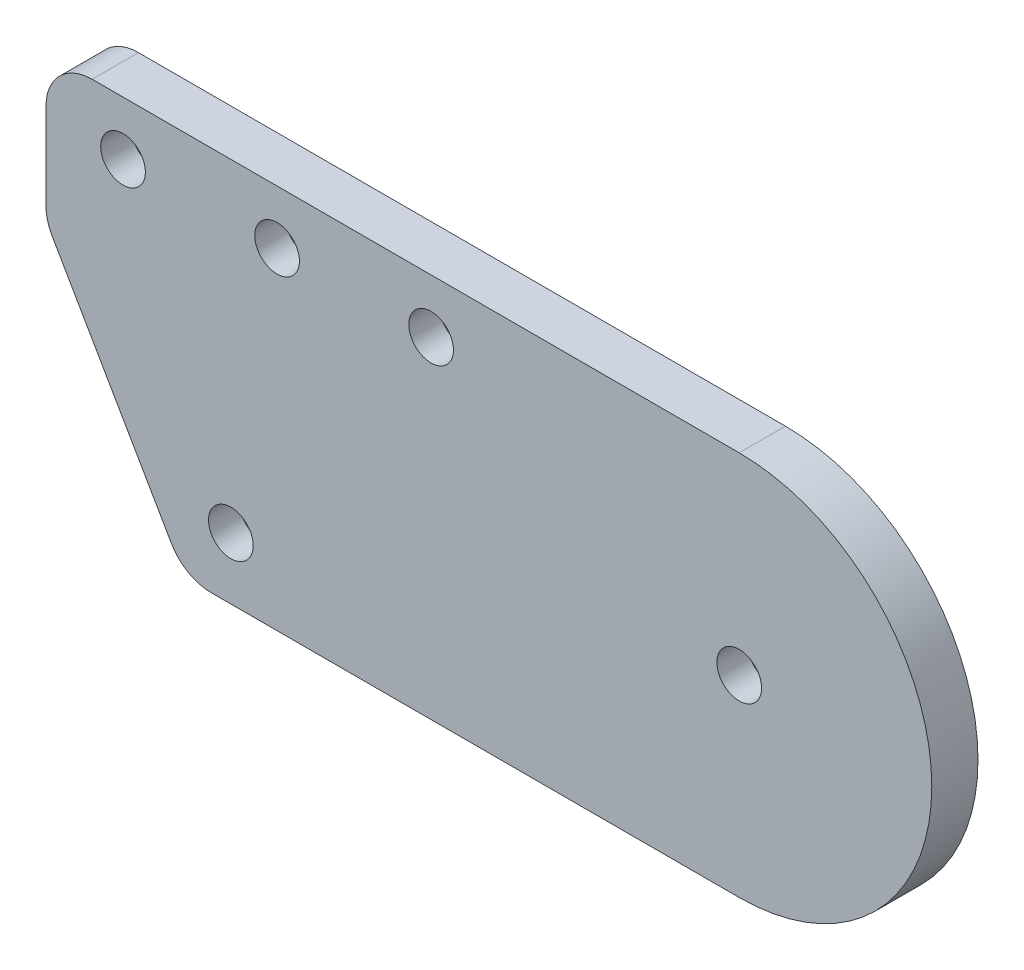
from build123d import *

# Parameters (mm, degrees)
SKETCH_2_R          = 1.45
EXTRUDE_1_DEPTH     = 3
SKETCH_3_R          = 1.45
EXTRUDE_2_DEPTH     = 3
SKETCH_6_R          = 3
CUT_EXTRUDE_2_DEPTH = 1
EXTRUDE_3_DEPTH     = 3
SKETCH_9_R          = 3.05
CUT_EXTRUDE_5_DEPTH = 1
FILLET_1_R          = 3
SKETCH_11_R         = 3.05
CUT_EXTRUDE_7_DEPTH = 1


with BuildPart() as part:
    # 草图2 → 凸台-拉伸1 (new body)
    with BuildSketch(Plane.XY):
        with BuildLine():
            Line((-10, -7), (-10, -16.423561614))
            Line((-10, -16.423561614), (30.724748208, -31.24615776))
            ThreePointArc((30.724748208, -31.24615776), (47.310096913, -21.670602221), (35, -7))
            Line((35, -7), (-10, -7))
        make_face()
        with Locations((35, -19.5)):
            Circle(SKETCH_2_R, mode=Mode.SUBTRACT)
        with Locations((15, -10.5)):
            Circle(SKETCH_2_R, mode=Mode.SUBTRACT)
        with Locations((5, -10.5)):
            Circle(SKETCH_2_R, mode=Mode.SUBTRACT)
        with Locations((-5, -10.5)):
            Circle(SKETCH_2_R, mode=Mode.SUBTRACT)
    extrude(amount=EXTRUDE_1_DEPTH)

    # 草图3 → 凸台-拉伸2 (add)
    with BuildSketch(Plane.XY.offset(3)):
        Polygon((-10, -16.423561614), (32.795912741, -32), (-1.006939105, -32), align=None)
        with Locations((2, -28)):
            Circle(SKETCH_3_R, mode=Mode.SUBTRACT)
    extrude(amount=-EXTRUDE_2_DEPTH)

    # 草图6 → 切除-拉伸2 (cut)
    with BuildSketch(Plane(origin=(0, 0, 0), x_dir=(-1, 0, 0), z_dir=(0, 0, -1))):
        with Locations((-15, -10.5)):
            Circle(SKETCH_6_R)
        with Locations((-5, -10.5)):
            Circle(SKETCH_6_R)
        with Locations((5, -10.5)):
            Circle(SKETCH_6_R)
    extrude(amount=-CUT_EXTRUDE_2_DEPTH, mode=Mode.SUBTRACT)

    # 草图8 → 凸台-拉伸3 (add)
    with BuildSketch(Plane.XY.offset(3)):
        Polygon((32.795912741, -32), (35, -32), (30.724748208, -31.24615776), align=None)
    extrude(amount=-EXTRUDE_3_DEPTH)

    # 草图9 → 切除-拉伸5 (cut)
    with BuildSketch(Plane(origin=(0, 0, 0), x_dir=(-1, 0, 0), z_dir=(0, 0, -1))):
        with Locations((-2, -28)):
            Circle(SKETCH_9_R)
    extrude(amount=-CUT_EXTRUDE_5_DEPTH, mode=Mode.SUBTRACT)

    # 圆角1
    fillet_1_edges = [part.edges().sort_by_distance(p)[0] for p in [
        (-1.006939105, -32, 1.5),
        (-10, -16.423561614, 1.5),
        (-10, -7, 1.5),
    ]]
    fillet(fillet_1_edges, radius=FILLET_1_R)

    # 草图11 → 切除-拉伸7 (cut)
    with BuildSketch(Plane(origin=(0, 0, 0), x_dir=(-1, 0, 0), z_dir=(0, 0, -1))):
        with Locations((-35, -19.5)):
            Circle(SKETCH_11_R)
    extrude(amount=-CUT_EXTRUDE_7_DEPTH, mode=Mode.SUBTRACT)


solid = part.part
